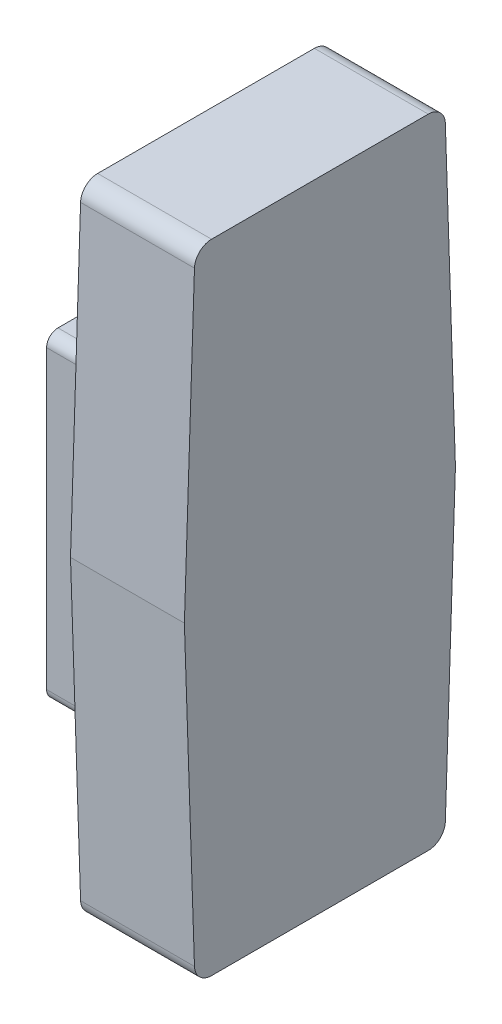
from build123d import *

# Parameters (mm, degrees)
BOSS_EXTRUDE1_DEPTH = 2.54
BOSS_EXTRUDE2_DEPTH = 1.016
SKETCH6_R           = 0.635
CUT_EXTRUDE1_DEPTH  = 2.54


with BuildPart() as part:
    # Sketch1 → Boss-Extrude1 (new body)
    with BuildSketch(Plane(origin=(0, 0, 0), x_dir=(0, 0, -1), z_dir=(1, 0, 0))):
        with BuildLine():
            Line((0.380788543, -13.474691937), (0.605560313, -6.731))
            Line((0.605560313, -6.731), (0.380788543, 0.012691937))
            ThreePointArc((0.380788543, 0.012691937), (0.2648824, 0.273858201), (0, 0.381))
            Line((0, 0.381), (-4.833515176, 0.381))
            ThreePointArc((-4.833515176, 0.381), (-5.098397576, 0.273858201), (-5.214303719, 0.012691937))
            Line((-5.214303719, 0.012691937), (-5.439075489, -6.731))
            Line((-5.439075489, -6.731), (-5.214303719, -13.474691937))
            ThreePointArc((-5.214303719, -13.474691937), (-5.098397576, -13.735858201), (-4.833515176, -13.843))
            Line((-4.833515176, -13.843), (0, -13.843))
            ThreePointArc((0, -13.843), (0.2648824, -13.735858201), (0.380788543, -13.474691937))
        make_face()
    extrude(amount=BOSS_EXTRUDE1_DEPTH)

    # Sketch5 → Boss-Extrude2 (add)
    with BuildSketch(Plane.ZY):
        with BuildLine():
            Line((0.130757588, -10.287), (4.702757588, -10.287))
            ThreePointArc((4.702757588, -10.287), (4.88236271, -10.212605122), (4.956757588, -10.033))
            Line((4.956757588, -10.033), (4.956757588, -3.429))
            ThreePointArc((4.956757588, -3.429), (4.88236271, -3.249394878), (4.702757588, -3.175))
            Line((4.702757588, -3.175), (0.130757588, -3.175))
            ThreePointArc((0.130757588, -3.175), (-0.048847535, -3.249394878), (-0.123242412, -3.429))
            Line((-0.123242412, -3.429), (-0.123242412, -10.033))
            ThreePointArc((-0.123242412, -10.033), (-0.048847535, -10.212605122), (0.130757588, -10.287))
        make_face()
    extrude(amount=BOSS_EXTRUDE2_DEPTH)

    # Sketch6 → Cut-Extrude1 (cut)
    with BuildSketch(Plane.ZY.offset(1.016)):
        with Locations((2.416757588, -5.461)):
            Circle(SKETCH6_R)
        with Locations((2.416757588, -8.001)):
            Circle(SKETCH6_R)
    extrude(amount=-CUT_EXTRUDE1_DEPTH, mode=Mode.SUBTRACT)


solid = part.part
